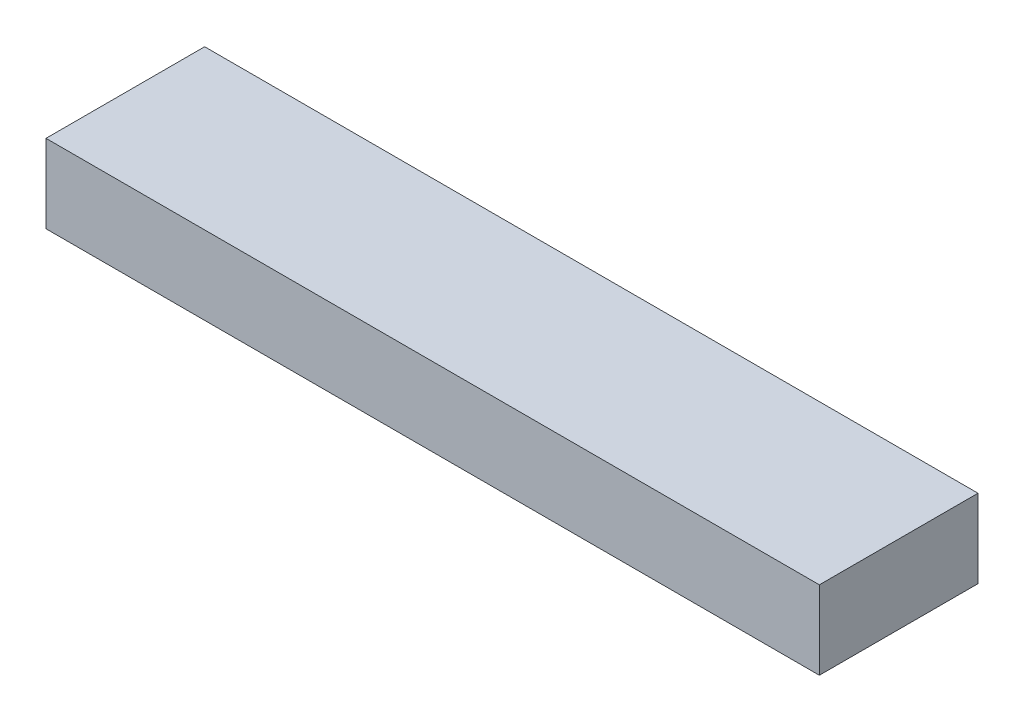
from build123d import *

# Parameters (mm, degrees)
REVOLVE1_ANGLE      = 180
SKETCH5_W           = 1002.922685695
SKETCH5_H           = 205.74
BOSS_EXTRUDE1_DEPTH = 38.1
SKETCH9_W           = 1002.922685695
SKETCH9_H           = 205.74
BOSS_EXTRUDE5_DEPTH = 101.6
FILLET1_R           = 3.175


with BuildPart() as part:
    # Sketch4 → Revolve1 (revolve)
    with BuildSketch(Plane(origin=(0, 0, 0), x_dir=(1, 0, 0), z_dir=(0, 1, 0))):
        with BuildLine():
            Line((838.2, 83.82), (1041.4, 83.82))
            Line((1041.4, 83.82), (1056.179727523, 0))
            Line((1056.179727523, 0), (78.657041828, 0))
            Line((78.657041828, 0), (83.91755407, 12.7))
            Line((83.91755407, 12.7), (96.61755407, 12.7))
            Line((96.61755407, 12.7), (98.163568293, 21.467882356))
            add(Edge.make_bspline(
                [(98.163568293, 21.467882356), (104.607343896, 22.497734344), (123.856103977, 25.493761031), (155.955742042, 30.152377402), (200.954778344, 36.105690484), (252.401123307, 42.315924819), (303.903852309, 48.038821007), (355.451699359, 53.337793152), (407.03781513, 58.250071041), (458.657158448, 62.799072617), (510.306365901, 66.995530477), (561.982906562, 70.840728542), (613.685068308, 74.325147511), (665.411655565, 77.427095788), (710.693213075, 79.771298327), (749.520698447, 81.471395458), (780.831665683, 82.597974895), (801.90983421, 83.214282129), (819.226060023, 83.601016067), (830.067936093, 83.761922773), (835.489248784, 83.813260117), (838.2, 83.82)],
                knots=[0.119382499, 0.119382499, 0.119382499, 0.119382499, 0.119382499, 0.150314205, 0.211721038, 0.273127872, 0.334534706, 0.395941541, 0.457348376, 0.518755211, 0.580162046, 0.641568881, 0.702975716, 0.764382551, 0.825789386, 0.887196222, 0.917899639, 0.948603057, 0.974301528, 0.987150764, 1, 1, 1, 1, 1], degree=4))
        make_face()
    revolve(axis=Axis((0, 0, 0), (1, 0, 0)), revolution_arc=REVOLVE1_ANGLE)

    # Sketch5 → Boss-Extrude1 (add)
    with BuildSketch(Plane.XZ):
        with Locations((567.418384676, 0)):
            Rectangle(SKETCH5_W, SKETCH5_H)
    extrude(amount=BOSS_EXTRUDE1_DEPTH)


with BuildPart() as body_2:
    # Sketch9 → Boss-Extrude5 (new body)
    with BuildSketch(Plane(origin=(0, 0, 0), x_dir=(1, 0, 0), z_dir=(0, 1, 0))):
        with Locations((567.418384676, 0)):
            Rectangle(SKETCH9_W, SKETCH9_H)
    extrude(amount=BOSS_EXTRUDE5_DEPTH)

    # Combine1: cut part
    add(part.part, mode=Mode.SUBTRACT)

    # Fillet1
    fillet1_edges = [body_2.edges().sort_by_distance(p)[0] for p in [
        (83.91755407, 12.7, 0),
        (1041.4, 83.82, 0),
        (98.163568293, 21.467882356, 0),
    ]]
    fillet(fillet1_edges, radius=FILLET1_R)


solid = body_2.part
